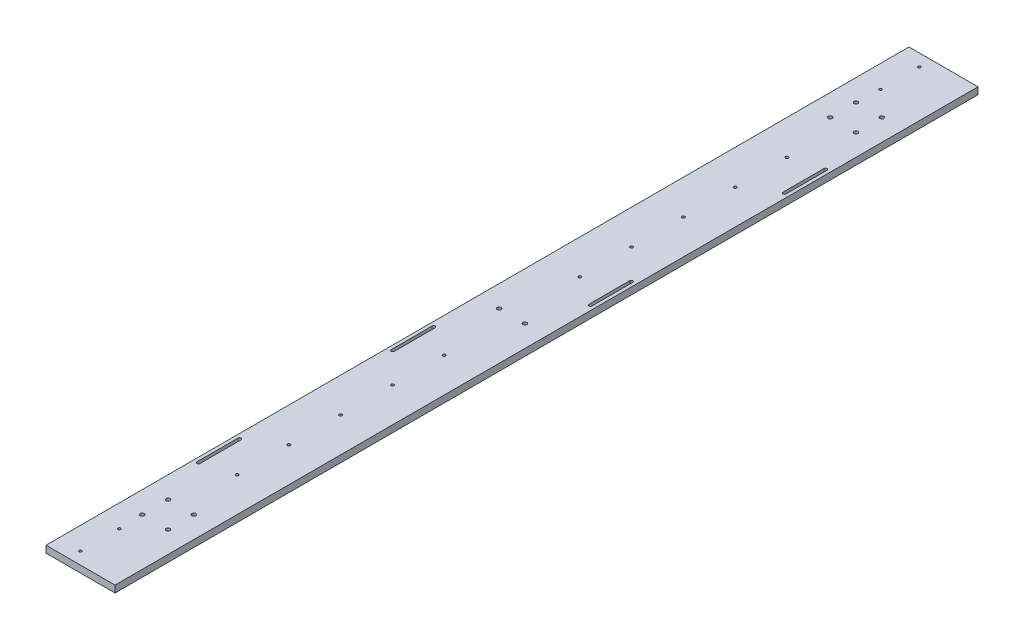
from build123d import *

# Parameters (mm, degrees)
SKETCH_1_W                  = 80
SKETCH_1_H                  = 8
EXTRUDE_1_DEPTH             = 1000
SKETCH_3_R                  = 4
CUT_EXTRUDE_1_DEPTH         = 5
SKETCH_4_R                  = 2.25
CUT_EXTRUDE_2_DEPTH         = 5
SKETCH_5_R                  = 2.25
CUT_EXTRUDE_3_DEPTH         = 8
PATTERN_LINEAR_1_COUNT      = 2
PATTERN_LINEAR_1_PITCH      = 30
PATTERN_LINEAR_1_COUNT_DIR2 = 2
PATTERN_LINEAR_1_PITCH_DIR2 = 30
SKETCH_6_R                  = 4
CUT_EXTRUDE_4_DEPTH         = 5
PATTERN_LINEAR_2_COUNT      = 2
PATTERN_LINEAR_2_PITCH      = 30
PATTERN_LINEAR_2_COUNT_DIR2 = 2
PATTERN_LINEAR_2_PITCH_DIR2 = 30
SKETCH_7_R                  = 2.25
CUT_EXTRUDE_5_DEPTH         = 8
PATTERN_LINEAR_3_COUNT      = 2
PATTERN_LINEAR_3_PITCH      = 30
PATTERN_LINEAR_3_COUNT_DIR2 = 2
PATTERN_LINEAR_3_PITCH_DIR2 = 30
SKETCH_8_R                  = 4
CUT_EXTRUDE_6_DEPTH         = 5
PATTERN_LINEAR_4_COUNT      = 2
PATTERN_LINEAR_4_PITCH      = 30
PATTERN_LINEAR_4_COUNT_DIR2 = 2
PATTERN_LINEAR_4_PITCH_DIR2 = 30
CUT_EXTRUDE_8_DEPTH         = 4
CUT_EXTRUDE_9_DEPTH         = 5
PATTERN_LINEAR_6_COUNT      = 2
PATTERN_LINEAR_6_PITCH      = 225
PATTERN_LINEAR_6_COL_COUNT  = 2
PATTERN_LINEAR_6_COL_PITCH  = 225
SKETCH_13_R                 = 1.5
CUT_EXTRUDE_10_DEPTH        = 8
SKETCH_14_R                 = 3
CUT_EXTRUDE_11_DEPTH        = 4
PATTERN_LINEAR_8_COUNT      = 2
PATTERN_LINEAR_8_PITCH      = 927
SKETCH_15_R                 = 1.65
CUT_EXTRUDE_12_DEPTH        = 10
PATTERN_LINEAR_9_COUNT      = 5
PATTERN_LINEAR_9_PITCH      = 60
SKETCH_16_R                 = 1.65
CUT_EXTRUDE_13_DEPTH        = 10
PATTERN_LINEAR_10_COUNT     = 5
PATTERN_LINEAR_10_PITCH     = 60


with BuildPart() as part:
    # Эскиз1 → Бобышка-Вытянуть1 (new body)
    with BuildSketch(Plane.XY):
        Rectangle(SKETCH_1_W, SKETCH_1_H)
    extrude(amount=EXTRUDE_1_DEPTH)

    # Эскиз3 → Вырез-Вытянуть1 (cut)
    with BuildSketch(Plane.XZ.offset(4)):
        with Locations(Location((15, 500, 0), (0, 0, 270))):
            Circle(SKETCH_3_R)
        with Locations(Location((-15, 500, 0), (0, 0, 270))):
            Circle(SKETCH_3_R)
    extrude(amount=-CUT_EXTRUDE_1_DEPTH, mode=Mode.SUBTRACT)

    # Эскиз4 → Вырез-Вытянуть2 (cut)
    with BuildSketch(Plane.XZ.offset(-1)):
        with Locations(Location((-15, 500, 0), (0, 0, 270))):
            Circle(SKETCH_4_R)
        with Locations(Location((15, 500, 0), (0, 0, 270))):
            Circle(SKETCH_4_R)
    extrude(amount=-CUT_EXTRUDE_2_DEPTH, mode=Mode.SUBTRACT)

    # Эскиз5 → Вырез-Вытянуть3 (cut)
    with BuildSketch(Plane.XZ.offset(4)):
        with Locations(Location((-15, 913.6, 0), (0, 0, 270))):
            Circle(SKETCH_5_R)
    cut_extrude_3 = extrude(amount=-CUT_EXTRUDE_3_DEPTH, mode=Mode.SUBTRACT)

    # Линейный массив1: Cut-Extrude 3 2 × 2
    with Locations(*[(i * PATTERN_LINEAR_1_PITCH, 0, -j * PATTERN_LINEAR_1_PITCH_DIR2) for i in range(PATTERN_LINEAR_1_COUNT) for j in range(PATTERN_LINEAR_1_COUNT_DIR2) if (i, j) != (0, 0)]):
        add(cut_extrude_3, mode=Mode.SUBTRACT)

    # Эскиз6 → Вырез-Вытянуть4 (cut)
    with BuildSketch(Plane.XZ.offset(4)):
        with Locations(Location((-15, 913.6, 0), (0, 0, 270))):
            Circle(SKETCH_6_R)
    cut_extrude_4 = extrude(amount=-CUT_EXTRUDE_4_DEPTH, mode=Mode.SUBTRACT)

    # Линейный массив2: Cut-Extrude 4 2 × 2
    with Locations(*[(i * PATTERN_LINEAR_2_PITCH, 0, -j * PATTERN_LINEAR_2_PITCH_DIR2) for i in range(PATTERN_LINEAR_2_COUNT) for j in range(PATTERN_LINEAR_2_COUNT_DIR2) if (i, j) != (0, 0)]):
        add(cut_extrude_4, mode=Mode.SUBTRACT)

    # Эскиз7 → Вырез-Вытянуть5 (cut)
    with BuildSketch(Plane.XZ.offset(4)):
        with Locations(Location((-15, 86.4, 0), (0, 0, 270))):
            Circle(SKETCH_7_R)
    cut_extrude_5 = extrude(amount=-CUT_EXTRUDE_5_DEPTH, mode=Mode.SUBTRACT)

    # Линейный массив3: Cut-Extrude 5 2 × 2
    with Locations(*[(i * PATTERN_LINEAR_3_PITCH, 0, j * PATTERN_LINEAR_3_PITCH_DIR2) for i in range(PATTERN_LINEAR_3_COUNT) for j in range(PATTERN_LINEAR_3_COUNT_DIR2) if (i, j) != (0, 0)]):
        add(cut_extrude_5, mode=Mode.SUBTRACT)

    # Эскиз8 → Вырез-Вытянуть6 (cut)
    with BuildSketch(Plane.XZ.offset(4)):
        with Locations(Location((-15, 86.4, 0), (0, 0, 270))):
            Circle(SKETCH_8_R)
    cut_extrude_6 = extrude(amount=-CUT_EXTRUDE_6_DEPTH, mode=Mode.SUBTRACT)

    # Линейный массив4: Cut-Extrude 6 2 × 2
    with Locations(*[(i * PATTERN_LINEAR_4_PITCH, 0, j * PATTERN_LINEAR_4_PITCH_DIR2) for i in range(PATTERN_LINEAR_4_COUNT) for j in range(PATTERN_LINEAR_4_COUNT_DIR2) if (i, j) != (0, 0)]):
        add(cut_extrude_6, mode=Mode.SUBTRACT)

    # Эскиз11 → Вырез-Вытянуть8 (cut)
    with BuildSketch(Plane.XZ.offset(4)):
        with BuildLine():
            Line((37.5, 220), (37.5, 170))
            ThreePointArc((37.5, 170), (34.5, 167), (31.5, 170))
            Line((31.5, 170), (31.5, 220))
            ThreePointArc((31.5, 220), (34.5, 223), (37.5, 220))
        make_face()
        with BuildLine():
            Line((-31.5, 830), (-31.5, 780))
            ThreePointArc((-31.5, 780), (-34.5, 777), (-37.5, 780))
            Line((-37.5, 780), (-37.5, 830))
            ThreePointArc((-37.5, 830), (-34.5, 833), (-31.5, 830))
        make_face()
    cut_extrude_8 = extrude(amount=-CUT_EXTRUDE_8_DEPTH, mode=Mode.SUBTRACT)

    # Эскиз12 → Вырез-Вытянуть9 (cut)
    with BuildSketch(Plane(origin=(0, 0, 0), x_dir=(-1, 0, 0), z_dir=(0, -1, 0))):
        with BuildLine():
            Line((-36.25, -218.75), (-36.25, -171.25))
            ThreePointArc((-36.25, -171.25), (-34.5, -169.5), (-32.75, -171.25))
            Line((-32.75, -171.25), (-32.75, -218.75))
            ThreePointArc((-32.75, -218.75), (-34.5, -220.5), (-36.25, -218.75))
        make_face()
        with BuildLine():
            Line((32.75, -828.75), (32.75, -781.25))
            ThreePointArc((32.75, -781.25), (34.5, -779.5), (36.25, -781.25))
            Line((36.25, -781.25), (36.25, -828.75))
            ThreePointArc((36.25, -828.75), (34.5, -830.5), (32.75, -828.75))
        make_face()
    cut_extrude_9 = extrude(amount=-CUT_EXTRUDE_9_DEPTH, mode=Mode.SUBTRACT)

    # Линейный массив6: Вырез-Вытянуть8, Вырез-Вытянуть9 ×2
    with Locations(*[(0, 0, i * PATTERN_LINEAR_6_PITCH) for i in range(1, PATTERN_LINEAR_6_COUNT)]):
        add(cut_extrude_8, mode=Mode.SUBTRACT)
        add(cut_extrude_9, mode=Mode.SUBTRACT)

    # Линейный массив6 col: Вырез-Вытянуть8, Вырез-Вытянуть9 ×2
    with Locations(*[(0, 0, -i * PATTERN_LINEAR_6_COL_PITCH) for i in range(1, PATTERN_LINEAR_6_COL_COUNT)]):
        add(cut_extrude_8, mode=Mode.SUBTRACT)
        add(cut_extrude_9, mode=Mode.SUBTRACT)

    # Эскиз13 → Вырез-Вытянуть10 (cut)
    with BuildSketch(Plane.XZ.offset(4)):
        with Locations(Location((-14, 59, 0), (0, 0, 270))):
            Circle(SKETCH_13_R)
        with Locations(Location((-14, 14, 0), (0, 0, 270))):
            Circle(SKETCH_13_R)
    cut_extrude_10 = extrude(amount=-CUT_EXTRUDE_10_DEPTH, mode=Mode.SUBTRACT)

    # Эскиз14 → Вырез-Вытянуть11 (cut)
    with BuildSketch(Plane.XZ.offset(4)):
        with Locations(Location((-14, 59, 0), (0, 0, 270))):
            Circle(SKETCH_14_R)
        with Locations(Location((-14, 14, 0), (0, 0, 270))):
            Circle(SKETCH_14_R)
    cut_extrude_11 = extrude(amount=-CUT_EXTRUDE_11_DEPTH, mode=Mode.SUBTRACT)

    # Линейный массив8: Вырез-Вытянуть10, Вырез-Вытянуть11 ×2
    with Locations(*[(0, 0, i * PATTERN_LINEAR_8_PITCH) for i in range(1, PATTERN_LINEAR_8_COUNT)]):
        add(cut_extrude_10, mode=Mode.SUBTRACT)
        add(cut_extrude_11, mode=Mode.SUBTRACT)

    # Эскиз15 → Вырез-Вытянуть12 (cut)
    with BuildSketch(Plane.XZ.offset(4)):
        with Locations(Location((0, 421.45, 0), (0, 0, 270))):
            Circle(SKETCH_15_R)
    cut_extrude_12 = extrude(amount=-CUT_EXTRUDE_12_DEPTH, mode=Mode.SUBTRACT)

    # Линейный массив9: Вырез-Вытянуть12 ×5
    with Locations(*[(0, 0, -i * PATTERN_LINEAR_9_PITCH) for i in range(1, PATTERN_LINEAR_9_COUNT)]):
        add(cut_extrude_12, mode=Mode.SUBTRACT)

    # Эскиз16 → Вырез-Вытянуть13 (cut)
    with BuildSketch(Plane.XZ.offset(4)):
        with Locations(Location((0, 578.55, 0), (0, 0, 270))):
            Circle(SKETCH_16_R)
    cut_extrude_13 = extrude(amount=-CUT_EXTRUDE_13_DEPTH, mode=Mode.SUBTRACT)

    # Линейный массив10: Вырез-Вытянуть13 ×5
    with Locations(*[(0, 0, i * PATTERN_LINEAR_10_PITCH) for i in range(1, PATTERN_LINEAR_10_COUNT)]):
        add(cut_extrude_13, mode=Mode.SUBTRACT)


solid = part.part
